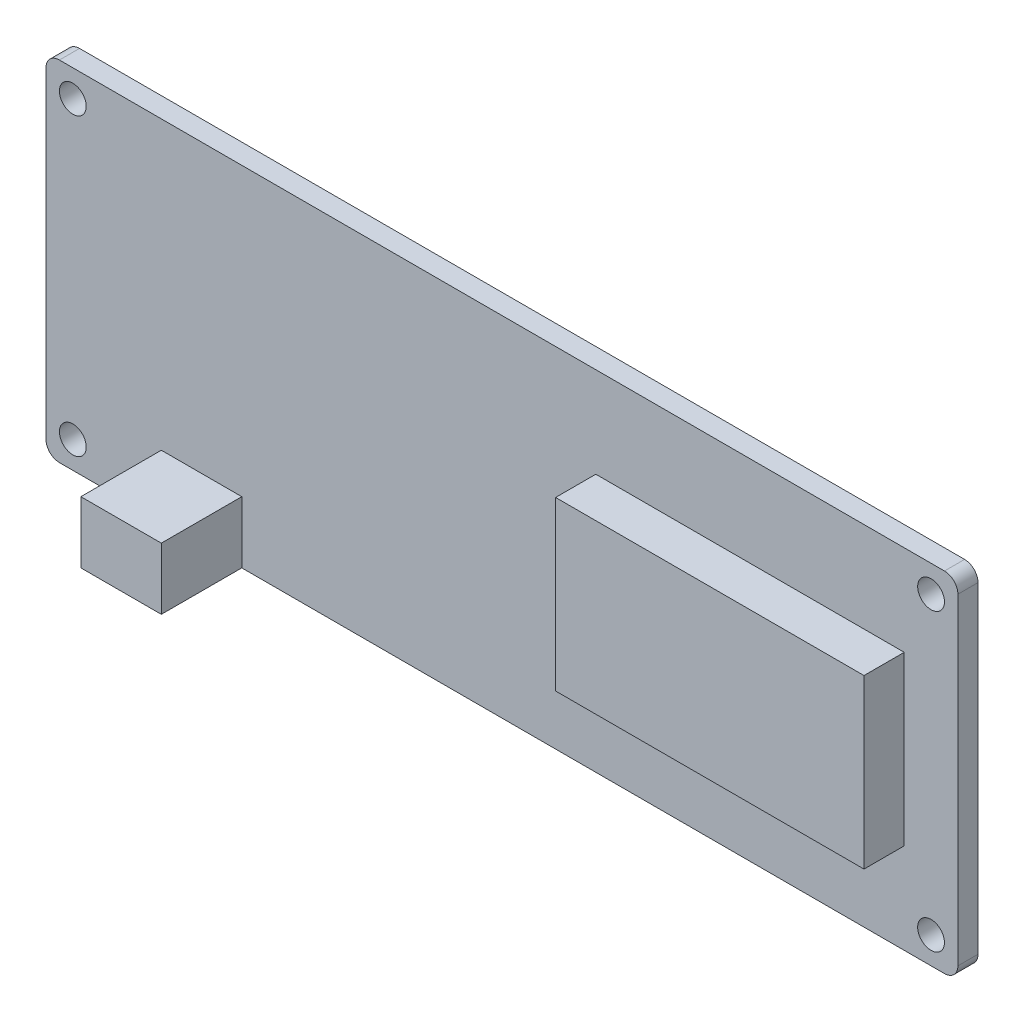
from build123d import *

# Parameters (mm, degrees)
SKETCH_1_R      = 1
EXTRUDE_1_DEPTH = 1.5
SKETCH_2_W      = 23
SKETCH_2_H      = 12.5
EXTRUDE_2_DEPTH = 3
SKETCH_3_W      = 6
SKETCH_3_H      = 4.6
EXTRUDE_3_DEPTH = 6


with BuildPart() as part:
    # 草圖1 → 填料-伸長1 (new body)
    with BuildSketch(Plane.XY):
        with BuildLine():
            Line((-33.501650513, -58.056539749), (32.498349487, -58.056539749))
            ThreePointArc((32.498349487, -58.056539749), (33.205456268, -57.76364653), (33.498349487, -57.056539749))
            Line((33.498349487, -57.056539749), (33.498349487, -33.056539749))
            ThreePointArc((33.498349487, -33.056539749), (33.205456268, -32.349432967), (32.498349487, -32.056539749))
            Line((32.498349487, -32.056539749), (-33.501650513, -32.056539749))
            ThreePointArc((-33.501650513, -32.056539749), (-34.208757294, -32.349432967), (-34.501650513, -33.056539749))
            Line((-34.501650513, -33.056539749), (-34.501650513, -57.056539749))
            ThreePointArc((-34.501650513, -57.056539749), (-34.208757294, -57.76364653), (-33.501650513, -58.056539749))
        make_face()
        with Locations((-32.501650513, -34.056539749)):
            Circle(SKETCH_1_R, mode=Mode.SUBTRACT)
        with Locations((-32.501650513, -56.056539749)):
            Circle(SKETCH_1_R, mode=Mode.SUBTRACT)
        with Locations((31.498349487, -56.056539749)):
            Circle(SKETCH_1_R, mode=Mode.SUBTRACT)
        with Locations((31.498349487, -34.056539749)):
            Circle(SKETCH_1_R, mode=Mode.SUBTRACT)
    extrude(amount=EXTRUDE_1_DEPTH)

    # 草圖2 → 填料-伸長2 (add)
    with BuildSketch(Plane.XY.offset(1.5)):
        with Locations((17.998349487, -45.056539749)):
            Rectangle(SKETCH_2_W, SKETCH_2_H)
    extrude(amount=EXTRUDE_2_DEPTH)

    # 草圖3 → 填料-伸長3 (add)
    with BuildSketch(Plane.XY.offset(1.5)):
        with Locations((-22.901650513, -55.756539749)):
            Rectangle(SKETCH_3_W, SKETCH_3_H)
    extrude(amount=EXTRUDE_3_DEPTH)


solid = part.part
